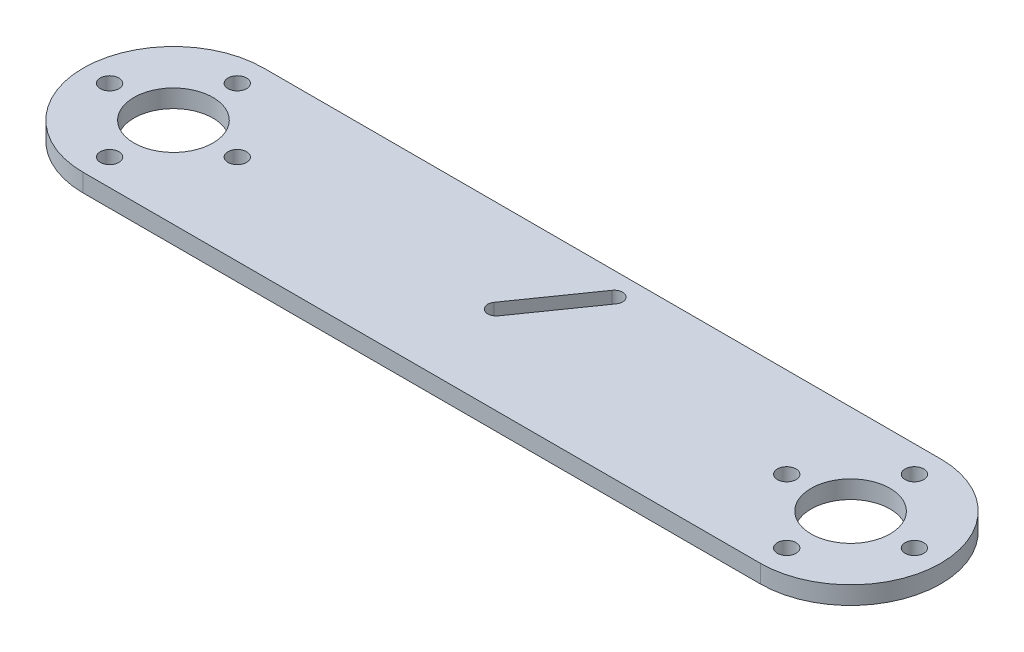
from build123d import *

# Parameters (mm, degrees)
SKETCH1_R           = 7
BOSS_EXTRUDE1_DEPTH = 3.175
SKETCH2_R           = 1.65
CUT_EXTRUDE1_DEPTH  = 10


with BuildPart() as part:
    # Sketch1 → Boss-Extrude1 (new body)
    with BuildSketch(Plane(origin=(0, 0, 0), x_dir=(1, 0, 0), z_dir=(0, 1, 0))):
        with BuildLine():
            Line((0, 0), (120, 0))
            ThreePointArc((120, 0), (136, 16), (120, 32))
            Line((120, 32), (0, 32))
            ThreePointArc((0, 32), (-16, 16), (0, 0))
        make_face()
        with Locations(Location((0, 16, 0), (0, 0, 270))):
            Circle(SKETCH1_R, mode=Mode.SUBTRACT)
        with Locations(Location((120, 16, 0), (0, 0, 270))):
            Circle(SKETCH1_R, mode=Mode.SUBTRACT)
        with BuildLine():
            Line((56.368317676, 16.477323769), (64.971964222, 28.764604433))
            ThreePointArc((64.971964222, 28.764604433), (67.061056942, 29.132967845), (67.429420354, 27.043875124))
            Line((67.429420354, 27.043875124), (58.825773809, 14.75659446))
            ThreePointArc((58.825773809, 14.75659446), (56.736681088, 14.388231048), (56.368317676, 16.477323769))
        make_face(mode=Mode.SUBTRACT)
    extrude(amount=BOSS_EXTRUDE1_DEPTH)

    # Sketch2 → Cut-Extrude1 (cut)
    with BuildSketch(Plane(origin=(0, 3.175, 0), x_dir=(1, 0, 0), z_dir=(0, 1, 0))):
        with Locations(Location((120, 27.313708499, 0), (0, 0, 270))):
            Circle(SKETCH2_R)
        with Locations(Location((108.686291501, 16, 0), (0, 0, 270))):
            Circle(SKETCH2_R)
        with Locations(Location((120, 4.686291501, 0), (0, 0, 270))):
            Circle(SKETCH2_R)
        with Locations(Location((131.313708499, 16, 0), (0, 0, 270))):
            Circle(SKETCH2_R)
        with Locations(Location((-11.313708499, 16, 0), (0, 0, 270))):
            Circle(SKETCH2_R)
        with Locations(Location((0, 27.313708499, 0), (0, 0, 270))):
            Circle(SKETCH2_R)
        with Locations(Location((11.313708499, 16, 0), (0, 0, 270))):
            Circle(SKETCH2_R)
        with Locations(Location((0, 4.686291501, 0), (0, 0, 270))):
            Circle(SKETCH2_R)
    extrude(amount=-CUT_EXTRUDE1_DEPTH, mode=Mode.SUBTRACT)


solid = part.part
